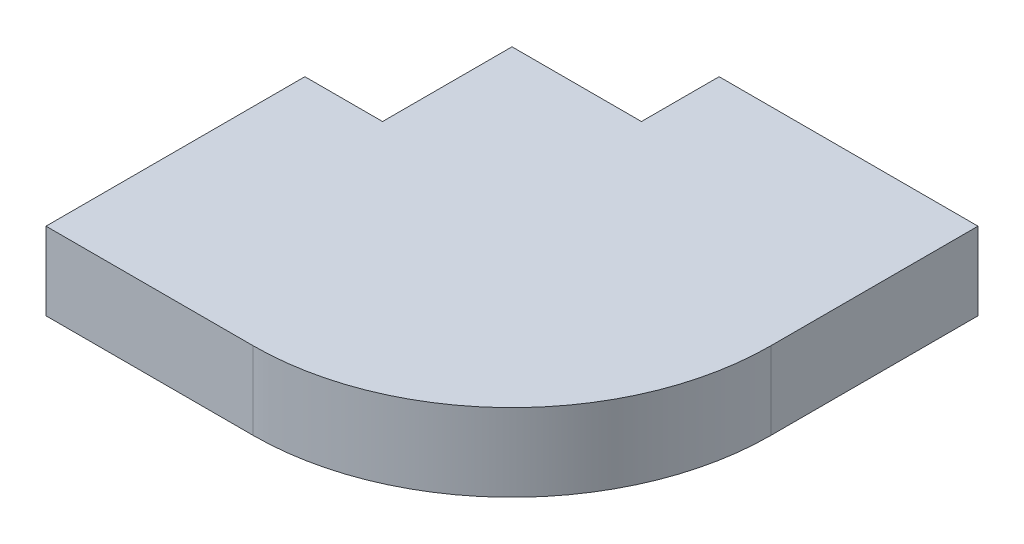
from build123d import *

# Parameters (mm, degrees)
BOSS_EXTRUDE1_DEPTH = 3


with BuildPart() as part:
    # Sketch1 → Boss-Extrude1 (new body)
    with BuildSketch(Plane(origin=(0, 0, 0), x_dir=(1, 0, 0), z_dir=(0, 1, 0))):
        with BuildLine():
            Line((-7.5, 2.5), (-10.5, 2.5))
            Line((-10.5, 2.5), (-10.5, -7.5))
            Line((-10.5, -7.5), (-7.5, -7.5))
            Line((-7.5, -7.5), (-2.5, -7.5))
            ThreePointArc((-2.5, -7.5), (4.571067812, -4.571067812), (7.5, 2.5))
            Line((7.5, 2.5), (7.5, 7.5))
            Line((7.5, 7.5), (7.5, 10.5))
            Line((7.5, 10.5), (-2.5, 10.5))
            Line((-2.5, 10.5), (-2.5, 7.5))
            Line((-2.5, 7.5), (-7.5, 7.5))
            Line((-7.5, 7.5), (-7.5, 2.5))
        make_face()
    extrude(amount=BOSS_EXTRUDE1_DEPTH)


solid = part.part
